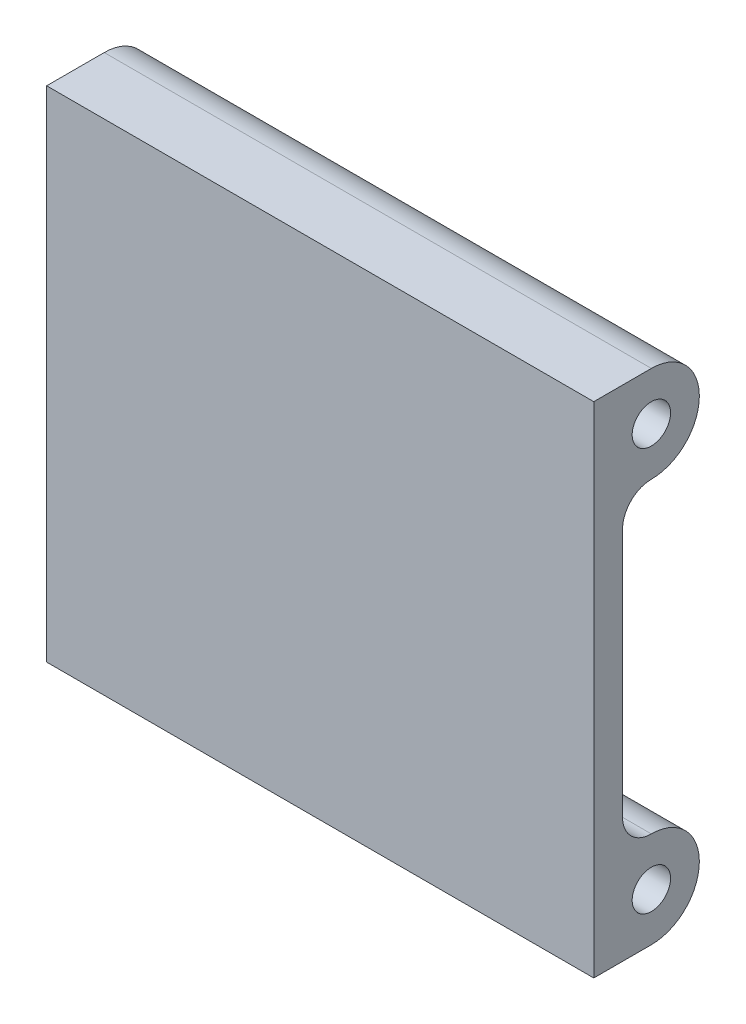
from build123d import *

# Parameters (mm, degrees)
SKETCH1_R           = 2
BOSS_EXTRUDE1_DEPTH = 28.5


with BuildPart() as part:
    # Sketch1 → Boss-Extrude1 (new, symmetric)
    with BuildSketch(Plane(origin=(0, 0, 0), x_dir=(0, 0, -1), z_dir=(1, 0, 0))):
        with BuildLine():
            Line((0, 0), (6, 0))
            ThreePointArc((6, 0), (11, 5), (6, 10))
            ThreePointArc((6, 10), (3.878679656, 10.878679656), (3, 13))
            Line((3, 13), (3, 39))
            ThreePointArc((3, 39), (3.878679656, 41.121320344), (6, 42))
            ThreePointArc((6, 42), (11, 47), (6, 52))
            Line((6, 52), (0, 52))
            Line((0, 52), (0, 0))
        make_face()
        with Locations(Location((6, 5, 0), (0, 0, 180))):
            Circle(SKETCH1_R, mode=Mode.SUBTRACT)
        with Locations(Location((6, 47, 0), (0, 0, 180))):
            Circle(SKETCH1_R, mode=Mode.SUBTRACT)
    extrude(amount=BOSS_EXTRUDE1_DEPTH, both=True)


solid = part.part
